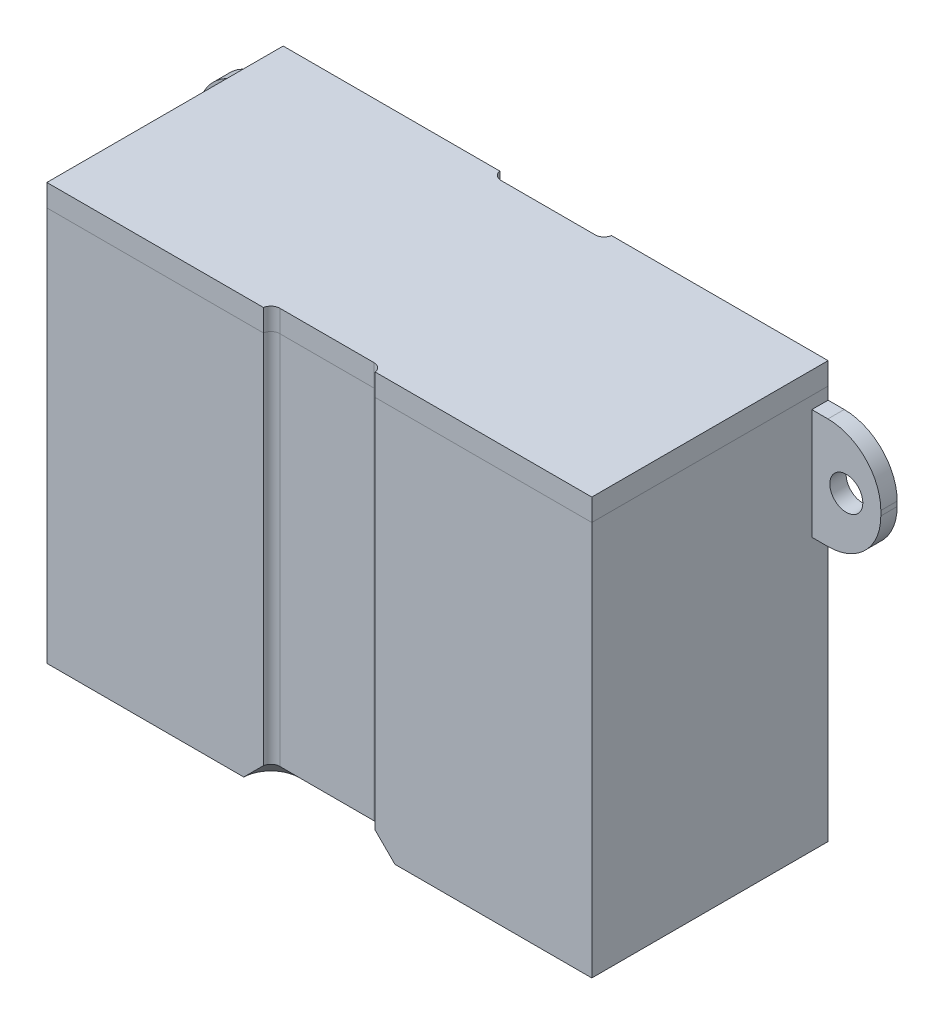
from build123d import *

# Parameters (mm, degrees)
SKETCH1_W               = 146.812
SKETCH1_H               = 57.912
BOSS_EXTRUDE1_DEPTH     = 108.55000007
SHELL1_T                = 5.08
CUT_EXTRUDE1_REACH      = 203.141
SKETCH2_R               = 8.89
CUT_EXTRUDE4_DEPTH      = 187.572089224
CUT_EXTRUDE4_DEPTH_BACK = 187.572089224
CHAMFER1_SIZE           = 5.682000066
BOSS_EXTRUDE2_DEPTH     = 6.35
SKETCH4_5_W             = 146.304
SKETCH4_5_H             = 57.404
BOSS_EXTRUDE3_DEPTH     = 5.08
CHAMFER2_SIZE           = 2.38
CHAMFER4_SIZE           = 1
CHAMFER5_SIZE           = 1
SKETCH6_W               = 22.5
SKETCH6_H               = 20.16
CUT_EXTRUDE6_DEPTH      = 5.08
CHAMFER6_SIZE           = 2.38
SKETCH8_R               = 4.75
BOSS_EXTRUDE4_DEPTH     = 4.699
SKETCH10_R              = 8.89
CUT_EXTRUDE10_DEPTH     = 25.4
SKETCH14_W              = 58.978157653
SKETCH14_H              = 44.368020442
BOSS_EXTRUDE7_DEPTH     = 25.4


with BuildPart() as part:
    # Sketch1 → Boss-Extrude1 (new body)
    with BuildSketch(Plane(origin=(0, 0, 0), x_dir=(1, 0, 0), z_dir=(0, 1, 0))):
        with Locations((47.913535633, 29.481052451)):
            Rectangle(SKETCH1_W, SKETCH1_H)
    extrude(amount=BOSS_EXTRUDE1_DEPTH)

    # Shell1
    shell1_openings = [part.faces().sort_by_distance(p)[0] for p in [
        (47.913535633, 108.55000007, -29.481052451),
    ]]
    offset(amount=SHELL1_T, openings=shell1_openings, kind=Kind.INTERSECTION)

    # Sketch2 → Cut-Extrude1 (cut, up to next)
    with BuildSketch(Plane.ZY.offset(30.572464367), mode=Mode.PRIVATE) as cut_extrude1_sk1:
        with Locations((-48.277052451, 35.814)):
            Circle(SKETCH2_R)
    cut_extrude1_tool1 = extrude(cut_extrude1_sk1.sketch, amount=-CUT_EXTRUDE1_REACH, mode=Mode.PRIVATE) & part.part
    add(cut_extrude1_tool1.solids().sort_by_distance((-30.572464, 35.814, -48.277052))[0], mode=Mode.SUBTRACT)

    # Sketch3 → Cut-Extrude4 (cut, two sides: drawn at the far end of the back side and taken through both)
    with BuildSketch(Plane(origin=(0, 108.55000007, -72.39), x_dir=(1, 0, 0), z_dir=(0, -1, 0)).offset(-CUT_EXTRUDE4_DEPTH_BACK)):
        with BuildLine():
            Line((31.800898604, 8.504686505), (31.800898604, 0.374266878))
            Line((31.800898604, 0.374266878), (64.026172661, 0.374266878))
            Line((64.026172661, 0.374266878), (64.026172661, 8.504686505))
            ThreePointArc((64.026172661, 8.504686505), (63.282223886, 10.300737729), (61.486172661, 11.044686505))
            Line((61.486172661, 11.044686505), (34.340898604, 11.044686505))
            ThreePointArc((34.340898604, 11.044686505), (32.54484738, 10.300737729), (31.800898604, 8.504686505))
        make_face()
        with BuildLine():
            Line((31.800898604, 85.44362822), (64.026172661, 85.44362822))
            Line((64.026172661, 85.44362822), (64.026172661, 77.313208593))
            ThreePointArc((64.026172661, 77.313208593), (63.282223886, 75.517157369), (61.486172661, 74.773208593))
            Line((61.486172661, 74.773208593), (34.340898604, 74.773208593))
            ThreePointArc((34.340898604, 74.773208593), (32.54484738, 75.517157369), (31.800898604, 77.313208593))
            Line((31.800898604, 77.313208593), (31.800898604, 85.44362822))
        make_face()
    extrude(amount=CUT_EXTRUDE4_DEPTH + CUT_EXTRUDE4_DEPTH_BACK, mode=Mode.SUBTRACT)

    # Chamfer1
    chamfer1_edges = [part.edges().sort_by_distance(p)[0] for p in [
        (32.680143211, -5.08, 3.001362729),
        (63.146928054, -5.08, -61.963467631),
        (47.913535633, -5.08, -61.345313495),
        (32.680143211, -5.08, -61.963467631),
        (47.913535633, -5.08, 2.383208593),
        (63.146928054, -5.08, 3.001362729),
    ]]
    chamfer(chamfer1_edges, length=CHAMFER1_SIZE)

    # Chamfer4
    chamfer4_edges = [part.edges().sort_by_distance(p)[0] for p in [
        (121.319535633, 108.55000007, -29.481052451),
        (47.913535633, 108.55000007, -58.437052451),
        (47.913535633, 108.55000007, -0.525052451),
        (-25.492464367, 108.55000007, -29.481052451),
    ]]
    chamfer(chamfer4_edges, length=CHAMFER4_SIZE)

    # Chamfer5
    chamfer5_edges = [part.edges().sort_by_distance(p)[0] for p in [
        (-30.572464367, 35.814, -57.167052451),
    ]]
    chamfer(chamfer5_edges, length=CHAMFER5_SIZE)

    # Sketch6 → Cut-Extrude6 (cut)
    with BuildSketch(Plane.ZY.offset(30.572464367)):
        with Locations((-29.481052451, 108.55000007)):
            Rectangle(SKETCH6_W, SKETCH6_H)
    extrude(amount=-CUT_EXTRUDE6_DEPTH, mode=Mode.SUBTRACT)

    # Chamfer6
    chamfer6_edges = [part.edges().sort_by_distance(p)[0] for p in [
        (-28.532464367, 108.55000007, -18.231052451),
        (-28.032464367, 98.47000007, -18.231052451),
        (-28.032464367, 98.47000007, -40.731052451),
        (-28.532464367, 108.55000007, -40.731052451),
    ]]
    chamfer(chamfer6_edges, length=CHAMFER6_SIZE)

    # Sketch8 → Boss-Extrude4 (add)
    # profile 1 of 3: a face of its own
    with BuildSketch(Plane(origin=(0, -31.597052283, -63.517052451), x_dir=(1, 0, 0), z_dir=(0, 0, 1))):
        with BuildLine():
            Line((-50.452696683, 120.027791223), (-50.452696716, 121.385755516))
            ThreePointArc((-50.452696716, 121.385755516), (-45.989005942, 132.162061359), (-35.212701658, 136.625755894))
            Line((-35.212701658, 136.625755894), (-30.572464367, 136.625757399))
            Line((-30.572464367, 136.625757399), (-30.572464367, 104.787793105))
            Line((-30.572464367, 104.787793105), (-35.212691741, 104.787791601))
            ThreePointArc((-35.212691741, 104.787791601), (-45.989002147, 109.251482375), (-50.452696683, 120.027791223))
        make_face()
        with Locations((-40.512580533, 120.706771713)):
            Circle(SKETCH8_R, mode=Mode.SUBTRACT)
    # profile 2 of 3: a face of its own
    with BuildSketch(Plane(origin=(0, -31.597052283, -63.517052451), x_dir=(1, 0, 0), z_dir=(0, 0, 1))):
        with BuildLine():
            Line((-30.572464367, 61.876311531), (-30.572464367, 30.038347237))
            Line((-30.572464367, 30.038347237), (-35.212701658, 30.038348742))
            ThreePointArc((-35.212701658, 30.038348742), (-45.989005942, 34.502043277), (-50.452696716, 45.27834912))
            Line((-50.452696716, 45.27834912), (-50.452696683, 46.636313414))
            ThreePointArc((-50.452696683, 46.636313414), (-45.989002147, 57.412622262), (-35.212691741, 61.876313036))
            Line((-35.212691741, 61.876313036), (-30.572464367, 61.876311531))
        make_face()
        with Locations(Location((-40.512580533, 45.957332923, 0), (0, 0, 180))):
            Circle(SKETCH8_R, mode=Mode.SUBTRACT)
    # profile 3 of 3: a face of its own
    with BuildSketch(Plane(origin=(0, -31.597052283, -63.517052451), x_dir=(1, 0, 0), z_dir=(0, 0, 1))):
        with BuildLine():
            Line((126.399535633, 104.787793105), (126.399535633, 136.625757399))
            Line((126.399535633, 136.625757399), (131.039772923, 136.625755894))
            ThreePointArc((131.039772923, 136.625755894), (141.816077208, 132.162061359), (146.279767981, 121.385755516))
            Line((146.279767981, 121.385755516), (146.279767948, 120.027791223))
            ThreePointArc((146.279767948, 120.027791223), (141.816073412, 109.251482375), (131.039763006, 104.787791601))
            Line((131.039763006, 104.787791601), (126.399535633, 104.787793105))
        make_face()
        with Locations(Location((136.339651799, 120.706771713, 0), (0, 0, 180))):
            Circle(SKETCH8_R, mode=Mode.SUBTRACT)
    extrude(amount=BOSS_EXTRUDE4_DEPTH)

    # Sketch10 → Cut-Extrude10 (cut)
    with BuildSketch(Plane.ZY.offset(30.572464367)):
        with Locations((-18.813052451, 35.814)):
            Circle(SKETCH10_R)
    extrude(amount=-CUT_EXTRUDE10_DEPTH, mode=Mode.SUBTRACT)

    # Sketch14 → Boss-Extrude7 (add)
    with BuildSketch(Plane.ZY.offset(-121.319535633)):
        with Locations((-29.489078827, 22.184010221)):
            Rectangle(SKETCH14_W, SKETCH14_H)
    extrude(amount=BOSS_EXTRUDE7_DEPTH)


with BuildPart() as body_2:
    # Sketch4 → Boss-Extrude2 (new body)
    with BuildSketch(Plane(origin=(0, 108.55000007, 0), x_dir=(1, 0, 0), z_dir=(0, 1, 0))):
        with BuildLine():
            Line((31.827736491, 63.517052451), (-30.572464367, 63.517052451))
            Line((-30.572464367, 63.517052451), (-30.572464367, -4.554947549))
            Line((-30.572464367, -4.554947549), (31.827736491, -4.554947549))
            ThreePointArc((31.827736491, -4.554947549), (32.680143211, -3.001362729), (34.340898604, -2.383208593))
            Line((34.340898604, -2.383208593), (61.486172661, -2.383208593))
            ThreePointArc((61.486172661, -2.383208593), (63.146928054, -3.001362729), (63.999334774, -4.554947549))
            Line((63.999334774, -4.554947549), (126.399535633, -4.554947549))
            Line((126.399535633, -4.554947549), (126.399535633, 63.517052451))
            Line((126.399535633, 63.517052451), (63.999334774, 63.517052451))
            ThreePointArc((63.999334774, 63.517052451), (63.146928054, 61.963467631), (61.486172661, 61.345313495))
            Line((61.486172661, 61.345313495), (34.340898604, 61.345313495))
            ThreePointArc((34.340898604, 61.345313495), (32.680143211, 61.963467631), (31.827736491, 63.517052451))
        make_face()
    extrude(amount=BOSS_EXTRUDE2_DEPTH)

    # Sketch4<5> → Boss-Extrude3 (add)
    with BuildSketch(Plane(origin=(0, 108.55000007, 0), x_dir=(1, 0, 0), z_dir=(0, 1, 0))):
        with Locations((47.913535633, 29.481052451)):
            Rectangle(SKETCH4_5_W, SKETCH4_5_H)
    extrude(amount=-BOSS_EXTRUDE3_DEPTH)

    # Chamfer2
    chamfer2_edges = [body_2.edges().sort_by_distance(p)[0] for p in [
        (121.065535633, 103.47000007, -29.481052451),
        (47.913535633, 103.47000007, -0.779052451),
        (-25.238464367, 103.47000007, -29.481052451),
        (47.913535633, 103.47000007, -58.183052451),
    ]]
    chamfer(chamfer2_edges, length=CHAMFER2_SIZE)


solid = Compound([part.part, body_2.part])
